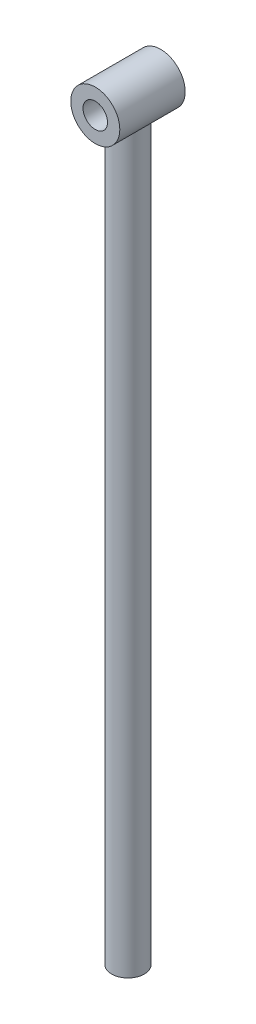
from build123d import *

# Parameters (mm, degrees)
SKETCH1_R                = 30
SKETCH1_R_2              = 15
BOSS_EXTRUDE1_DEPTH      = 40
BOSS_EXTRUDE2_REACH      = 953.315
BOSS_EXTRUDE2_END_RADIUS = 30
SKETCH2_R                = 20


with BuildPart() as part:
    # Sketch1 → Boss-Extrude1 (new, symmetric)
    with BuildSketch(Plane.XY):
        Circle(SKETCH1_R)
        Circle(SKETCH1_R_2, mode=Mode.SUBTRACT)
    extrude(amount=BOSS_EXTRUDE1_DEPTH, both=True)

    # Boss-Extrude2: up to this cylinder (the profile starts outside it)
    boss_extrude2_end = Plane(origin=(0, 0, 0), z_dir=(0, 0, -1)) * Cylinder(BOSS_EXTRUDE2_END_RADIUS, 1967.63, mode=Mode.PRIVATE)
    # Sketch2 → Boss-Extrude2 (add, up to the surface)
    with BuildSketch(Plane(origin=(0, -920, 0), x_dir=(1, 0, 0), z_dir=(0, 1, 0)), mode=Mode.PRIVATE) as boss_extrude2_sk1:
        with Locations(Location((0, 0, 0), (0, 0, 90))):
            Circle(SKETCH2_R)
    boss_extrude2_tool1 = extrude(boss_extrude2_sk1.sketch, amount=BOSS_EXTRUDE2_REACH, mode=Mode.PRIVATE) - boss_extrude2_end
    add(boss_extrude2_tool1.solids().sort_by_distance((0, -920, 0))[0])


solid = part.part
